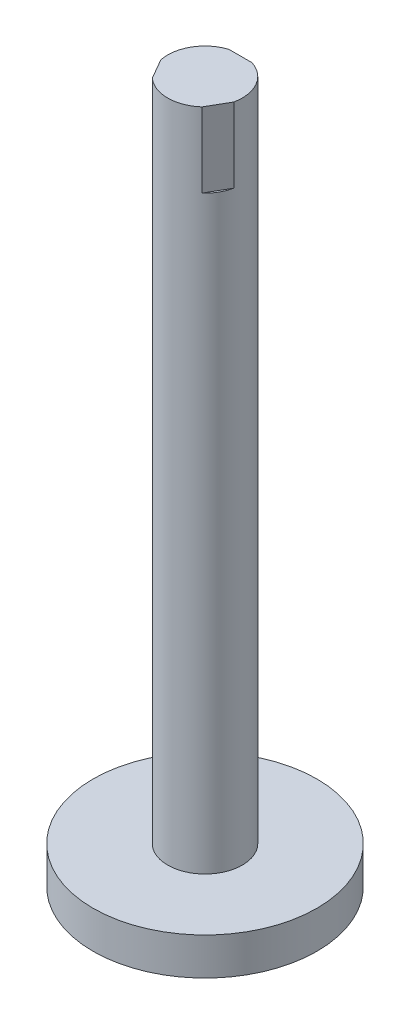
from build123d import *

# Parameters (mm, degrees)
SKETCH1_R           = 15
BOSS_EXTRUDE1_DEPTH = 5
SKETCH2_R           = 5
BOSS_EXTRUDE2_DEPTH = 89
CUT_EXTRUDE2_START  = -10
CUT_EXTRUDE2_DEPTH  = 10
CIRPATTERN1_COUNT   = 3


with BuildPart() as part:
    # Sketch1 → Boss-Extrude1 (new body)
    with BuildSketch(Plane(origin=(0, 0, 0), x_dir=(1, 0, 0), z_dir=(0, 1, 0))):
        with Locations(Location((0, 0, 0), (0, 0, 270))):
            Circle(SKETCH1_R)
    extrude(amount=-BOSS_EXTRUDE1_DEPTH)

    # Sketch2 → Boss-Extrude2 (add)
    with BuildSketch(Plane(origin=(0, 0, 0), x_dir=(1, 0, 0), z_dir=(0, 1, 0))):
        with Locations(Location((0, 0, 0), (0, 0, 270))):
            Circle(SKETCH2_R)
    extrude(amount=BOSS_EXTRUDE2_DEPTH)

    # Sketch7 → Cut-Extrude2 (cut)
    with BuildSketch(Plane(origin=(0, 89, 0), x_dir=(1, 0, 0), z_dir=(0, 1, 0)).offset(CUT_EXTRUDE2_START)):
        with BuildLine():
            Line((-1.5612495, 4.75), (1.5612495, 4.75))
            ThreePointArc((1.5612495, 4.75), (0, 5), (-1.5612495, 4.75))
        make_face()
    cut_extrude2 = extrude(amount=CUT_EXTRUDE2_DEPTH, mode=Mode.SUBTRACT)

    # CirPattern1: Cut-Extrude2 ×3 about axis
    cirpattern1_axis = Axis((0, 0, 0), (0, 1, 0))
    for i in range(1, CIRPATTERN1_COUNT):
        add(cut_extrude2.rotate(cirpattern1_axis, i * 360 / CIRPATTERN1_COUNT), mode=Mode.SUBTRACT)


solid = part.part
